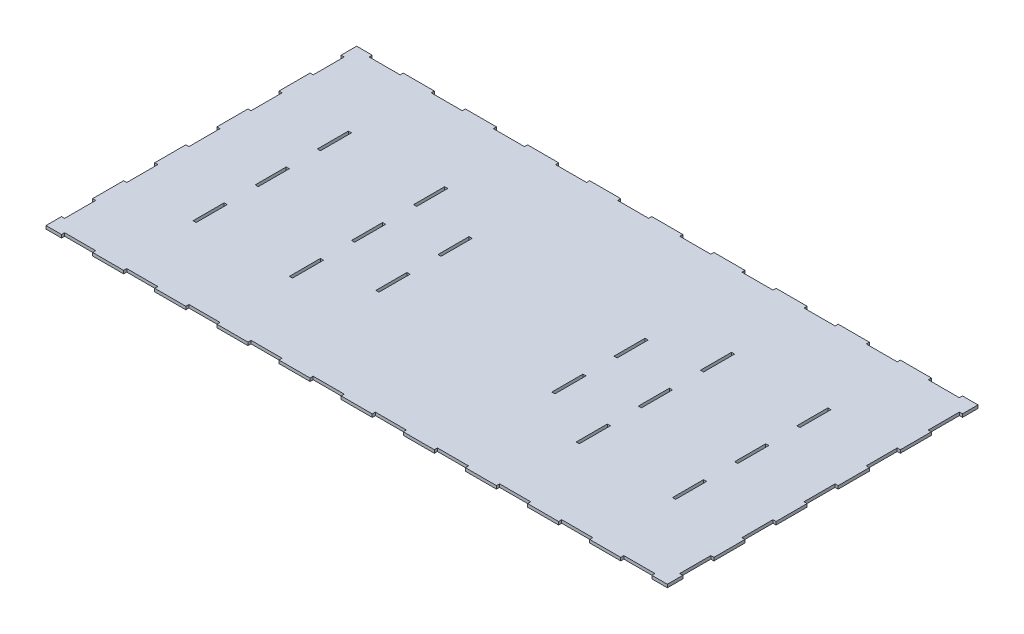
from build123d import *

# Parameters (mm, degrees)
SKETCH1_W           = 600
SKETCH1_H           = 300
BOSS_EXTRUDE1_DEPTH = 3
SKETCH2_W           = 30
SKETCH2_H           = 3
SKETCH2_W_2         = 3
SKETCH2_H_2         = 30
CUT_EXTRUDE1_DEPTH  = 5
SKETCH3_W           = 3
SKETCH3_H           = 30
CUT_EXTRUDE2_DEPTH  = 10
SKETCH4_W           = 3
SKETCH4_H           = 30
CUT_EXTRUDE3_DEPTH  = 5


with BuildPart() as part:
    # Sketch1 → Boss-Extrude1 (new body)
    with BuildSketch(Plane(origin=(0, 0, 0), x_dir=(1, 0, 0), z_dir=(0, 1, 0))):
        with Locations((300, 150)):
            Rectangle(SKETCH1_W, SKETCH1_H)
    extrude(amount=BOSS_EXTRUDE1_DEPTH)

    # Sketch2 → Cut-Extrude1 (cut)
    with BuildSketch(Plane(origin=(0, 3, 0), x_dir=(1, 0, 0), z_dir=(0, 1, 0))):
        with Locations((90, 1.5)):
            Rectangle(SKETCH2_W, SKETCH2_H)
        with Locations((30, 1.5)):
            Rectangle(SKETCH2_W, SKETCH2_H)
        with Locations((150, 1.5)):
            Rectangle(SKETCH2_W, SKETCH2_H)
        with Locations((210, 1.5)):
            Rectangle(SKETCH2_W, SKETCH2_H)
        with Locations((270, 1.5)):
            Rectangle(SKETCH2_W, SKETCH2_H)
        with Locations((330, 1.5)):
            Rectangle(SKETCH2_W, SKETCH2_H)
        with Locations((390, 1.5)):
            Rectangle(SKETCH2_W, SKETCH2_H)
        with Locations((450, 1.5)):
            Rectangle(SKETCH2_W, SKETCH2_H)
        with Locations((510, 1.5)):
            Rectangle(SKETCH2_W, SKETCH2_H)
        with Locations((570, 1.5)):
            Rectangle(SKETCH2_W, SKETCH2_H)
        with Locations((570, 298.5)):
            Rectangle(SKETCH2_W, SKETCH2_H)
        with Locations((510, 298.5)):
            Rectangle(SKETCH2_W, SKETCH2_H)
        with Locations((450, 298.5)):
            Rectangle(SKETCH2_W, SKETCH2_H)
        with Locations((390, 298.5)):
            Rectangle(SKETCH2_W, SKETCH2_H)
        with Locations((330, 298.5)):
            Rectangle(SKETCH2_W, SKETCH2_H)
        with Locations((270, 298.5)):
            Rectangle(SKETCH2_W, SKETCH2_H)
        with Locations((210, 298.5)):
            Rectangle(SKETCH2_W, SKETCH2_H)
        with Locations((150, 298.5)):
            Rectangle(SKETCH2_W, SKETCH2_H)
        with Locations((90, 298.5)):
            Rectangle(SKETCH2_W, SKETCH2_H)
        with Locations((30, 298.5)):
            Rectangle(SKETCH2_W, SKETCH2_H)
        with Locations((1.5, 210)):
            Rectangle(SKETCH2_W_2, SKETCH2_H_2)
        with Locations((1.5, 270)):
            Rectangle(SKETCH2_W_2, SKETCH2_H_2)
        with Locations((1.5, 150)):
            Rectangle(SKETCH2_W_2, SKETCH2_H_2)
        with Locations((1.5, 90)):
            Rectangle(SKETCH2_W_2, SKETCH2_H_2)
        with Locations((1.5, 30)):
            Rectangle(SKETCH2_W_2, SKETCH2_H_2)
        with Locations((598.5, 30)):
            Rectangle(SKETCH2_W_2, SKETCH2_H_2)
        with Locations((598.5, 90)):
            Rectangle(SKETCH2_W_2, SKETCH2_H_2)
        with Locations((598.5, 150)):
            Rectangle(SKETCH2_W_2, SKETCH2_H_2)
        with Locations((598.5, 210)):
            Rectangle(SKETCH2_W_2, SKETCH2_H_2)
        with Locations((598.5, 270)):
            Rectangle(SKETCH2_W_2, SKETCH2_H_2)
    extrude(amount=-CUT_EXTRUDE1_DEPTH, mode=Mode.SUBTRACT)

    # Sketch3 → Cut-Extrude2 (cut)
    with BuildSketch(Plane(origin=(0, 3, 0), x_dir=(1, 0, 0), z_dir=(0, 1, 0))):
        with Locations((68.5, 210)):
            Rectangle(SKETCH3_W, SKETCH3_H)
        with Locations((68.5, 150)):
            Rectangle(SKETCH3_W, SKETCH3_H)
        with Locations((68.5, 90)):
            Rectangle(SKETCH3_W, SKETCH3_H)
        with Locations((161.5, 90)):
            Rectangle(SKETCH3_W, SKETCH3_H)
        with Locations((161.5, 150)):
            Rectangle(SKETCH3_W, SKETCH3_H)
        with Locations((161.5, 210)):
            Rectangle(SKETCH3_W, SKETCH3_H)
        with Locations((438.5, 210)):
            Rectangle(SKETCH3_W, SKETCH3_H)
        with Locations((438.5, 150)):
            Rectangle(SKETCH3_W, SKETCH3_H)
        with Locations((438.5, 90)):
            Rectangle(SKETCH3_W, SKETCH3_H)
        with Locations((531.5, 90)):
            Rectangle(SKETCH3_W, SKETCH3_H)
        with Locations((531.5, 150)):
            Rectangle(SKETCH3_W, SKETCH3_H)
        with Locations((531.5, 210)):
            Rectangle(SKETCH3_W, SKETCH3_H)
    extrude(amount=-CUT_EXTRUDE2_DEPTH, mode=Mode.SUBTRACT)

    # Sketch4 → Cut-Extrude3 (cut)
    with BuildSketch(Plane(origin=(0, 3, 0), x_dir=(1, 0, 0), z_dir=(0, 1, 0))):
        with Locations((215, 180)):
            Rectangle(SKETCH4_W, SKETCH4_H)
        with Locations((215, 120)):
            Rectangle(SKETCH4_W, SKETCH4_H)
        with Locations((385, 120)):
            Rectangle(SKETCH4_W, SKETCH4_H)
        with Locations((385, 180)):
            Rectangle(SKETCH4_W, SKETCH4_H)
    extrude(amount=-CUT_EXTRUDE3_DEPTH, mode=Mode.SUBTRACT)


solid = part.part
